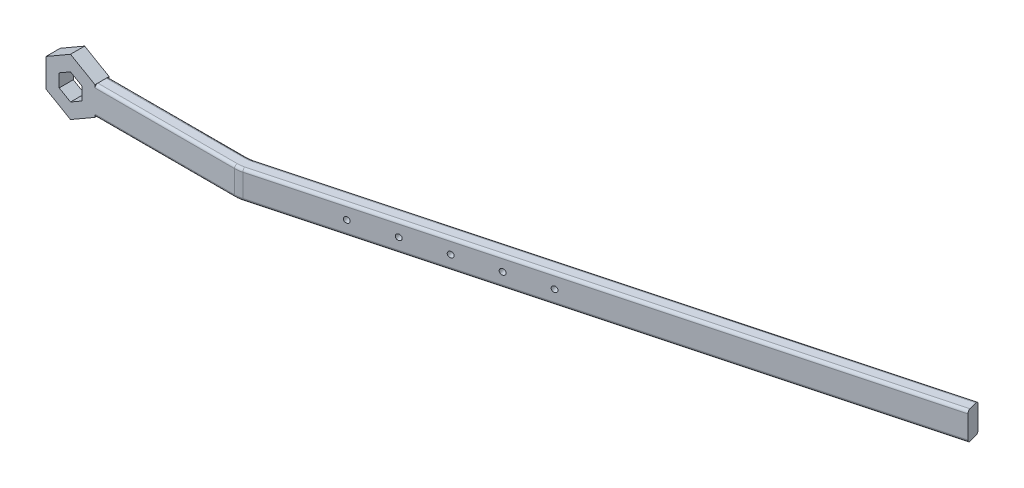
from build123d import *

# Parameters (mm, degrees)
BOSS_EXTRUDE1_DEPTH = 10
FILLET1_R           = 10
FILLET2_R           = 1
BOSS_EXTRUDE2_DEPTH = 5
CUT_EXTRUDE1_REACH  = 216.878
SKETCH3_R           = 1


with BuildPart() as part:
    # Sketch1 → Boss-Extrude1 (new body)
    with BuildSketch(Plane(origin=(0, 0, 0), x_dir=(1, 0, 0), z_dir=(0, 1, 0))):
        Polygon((-50, 11.795260846), (0, 11.795260846), (202.844423521, 66.147260317), (204.138518746, 61.317631186), (0.658262488, 6.795260846), (-50, 6.795260846), align=None)
    extrude(amount=BOSS_EXTRUDE1_DEPTH)

    # Fillet1
    fillet1_edges = [part.edges().sort_by_distance(p)[0] for p in [
        (0, 5, -11.795260846),
        (0.658262488, 5, -6.795260846),
    ]]
    fillet(fillet1_edges, radius=FILLET1_R)

    # Fillet2
    fillet2_edges = [part.edges().sort_by_distance(p)[0] for p in [
        (-25.658262488, 0, -11.795260846),
        (-25.658262488, 10, -11.795260846),
        (102.058044498, 10, -39.14163145),
        (103.034223355, 0, -34.226816884),
        (103.034223355, 10, -34.226816884),
        (0.646999434, 0, -6.880812232),
        (0.646999434, 10, -6.880812232),
        (-0.011263054, 0, -11.880812232),
        (-0.011263054, 10, -11.880812232),
        (102.058044498, 0, -39.14163145),
        (-25.329131244, 0, -6.795260846),
        (-25.329131244, 10, -6.795260846),
    ]]
    fillet(fillet2_edges, radius=FILLET2_R)

    # Sketch2 → Boss-Extrude2 (add)
    with BuildSketch(Plane.XY.offset(-6.795260846)):
        Polygon((-67.320508076, 0), (-58.660254038, -5), (-50, 0), (-50, 10), (-58.660254038, 15), (-67.320508076, 10), align=None)
        Polygon((-54.660254038, 2.690598923), (-54.660254038, 7.309401077), (-58.660254038, 9.618802154), (-62.660254038, 7.309401077), (-62.660254038, 2.690598923), (-58.660254038, 0.381197846), align=None, mode=Mode.SUBTRACT)
    extrude(amount=-BOSS_EXTRUDE2_DEPTH)

    # Sketch3 → Cut-Extrude1 (cut, up to next)
    with BuildSketch(Plane(origin=(-1.654719986, 0, -6.17549906), x_dir=(0.9659258262890681, 0, -0.2588190451025216), z_dir=(0.2588190451025216, 0, 0.9659258262890681)), mode=Mode.PRIVATE) as cut_extrude1_sk1:
        with Locations((33.711100637, 5)):
            Circle(SKETCH3_R)
    cut_extrude1_tool1 = extrude(cut_extrude1_sk1.sketch, amount=-CUT_EXTRUDE1_REACH, mode=Mode.PRIVATE) & part.part
    # Sketch3 → Cut-Extrude1 (cut, up to next)
    with BuildSketch(Plane(origin=(-1.654719986, 0, -6.17549906), x_dir=(0.9659258262890681, 0, -0.2588190451025216), z_dir=(0.2588190451025216, 0, 0.9659258262890681)), mode=Mode.PRIVATE) as cut_extrude1_sk2:
        with Locations((48.711100637, 5)):
            Circle(SKETCH3_R)
    cut_extrude1_tool2 = extrude(cut_extrude1_sk2.sketch, amount=-CUT_EXTRUDE1_REACH, mode=Mode.PRIVATE) & part.part
    # Sketch3 → Cut-Extrude1 (cut, up to next)
    with BuildSketch(Plane(origin=(-1.654719986, 0, -6.17549906), x_dir=(0.9659258262890681, 0, -0.2588190451025216), z_dir=(0.2588190451025216, 0, 0.9659258262890681)), mode=Mode.PRIVATE) as cut_extrude1_sk3:
        with Locations((63.711100637, 5)):
            Circle(SKETCH3_R)
    cut_extrude1_tool3 = extrude(cut_extrude1_sk3.sketch, amount=-CUT_EXTRUDE1_REACH, mode=Mode.PRIVATE) & part.part
    # Sketch3 → Cut-Extrude1 (cut, up to next)
    with BuildSketch(Plane(origin=(-1.654719986, 0, -6.17549906), x_dir=(0.9659258262890681, 0, -0.2588190451025216), z_dir=(0.2588190451025216, 0, 0.9659258262890681)), mode=Mode.PRIVATE) as cut_extrude1_sk4:
        with Locations((78.711100637, 5)):
            Circle(SKETCH3_R)
    cut_extrude1_tool4 = extrude(cut_extrude1_sk4.sketch, amount=-CUT_EXTRUDE1_REACH, mode=Mode.PRIVATE) & part.part
    # Sketch3 → Cut-Extrude1 (cut, up to next)
    with BuildSketch(Plane(origin=(-1.654719986, 0, -6.17549906), x_dir=(0.9659258262890681, 0, -0.2588190451025216), z_dir=(0.2588190451025216, 0, 0.9659258262890681)), mode=Mode.PRIVATE) as cut_extrude1_sk5:
        with Locations((93.711100637, 5)):
            Circle(SKETCH3_R)
    cut_extrude1_tool5 = extrude(cut_extrude1_sk5.sketch, amount=-CUT_EXTRUDE1_REACH, mode=Mode.PRIVATE) & part.part
    add(cut_extrude1_tool1.solids().sort_by_distance((30.907703, 5, -14.900574))[0], mode=Mode.SUBTRACT)
    add(cut_extrude1_tool2.solids().sort_by_distance((45.39659, 5, -18.78286))[0], mode=Mode.SUBTRACT)
    add(cut_extrude1_tool3.solids().sort_by_distance((59.885478, 5, -22.665145))[0], mode=Mode.SUBTRACT)
    add(cut_extrude1_tool4.solids().sort_by_distance((74.374365, 5, -26.547431))[0], mode=Mode.SUBTRACT)
    add(cut_extrude1_tool5.solids().sort_by_distance((88.863252, 5, -30.429717))[0], mode=Mode.SUBTRACT)


solid = part.part
